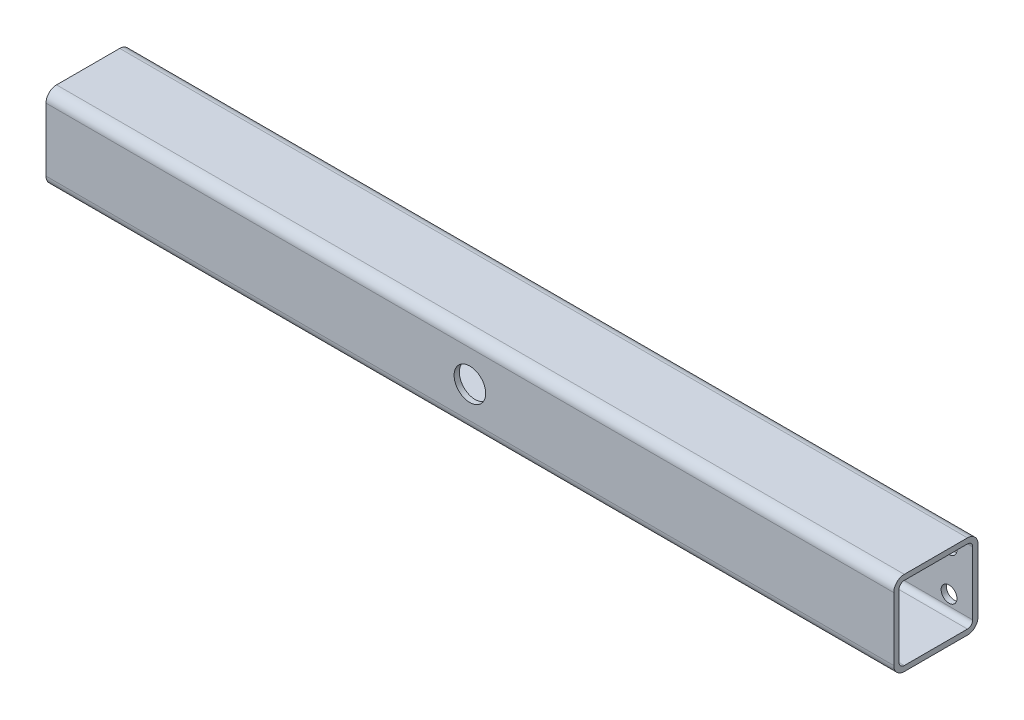
from build123d import *

# Parameters (mm, degrees)
BASE_EXTRUDE_DEPTH = 511.175
SKETCH3_R          = 19.05
CUT_EXTRUDE1_DEPTH = 25.4
SKETCH4_R          = 9.525
CUT_EXTRUDE2_DEPTH = 25.4
SKETCH5_R          = 3.9751
CUT_EXTRUDE3_DEPTH = 25.4


with BuildPart() as part:
    # Sketch1 → Base-Extrude (new, symmetric)
    with BuildSketch(Plane(origin=(0, 0, 0), x_dir=(0, 0, -1), z_dir=(1, 0, 0))):
        with BuildLine():
            Line((-127, 139.7), (-50.8, 139.7))
            ThreePointArc((-50.8, 139.7), (-41.819743879, 135.980256121), (-38.1, 127))
            Line((-38.1, 127), (-38.1, 50.8))
            ThreePointArc((-38.1, 50.8), (-41.819743879, 41.819743879), (-50.8, 38.1))
            Line((-50.8, 38.1), (-127, 38.1))
            ThreePointArc((-127, 38.1), (-135.980256121, 41.819743879), (-139.7, 50.8))
            Line((-139.7, 50.8), (-139.7, 127))
            ThreePointArc((-139.7, 127), (-135.980256121, 135.980256121), (-127, 139.7))
        make_face()
        with BuildLine():
            Line((-127, 133.35), (-50.8, 133.35))
            ThreePointArc((-50.8, 133.35), (-46.309871939, 131.490128061), (-44.45, 127))
            Line((-44.45, 127), (-44.45, 50.8))
            ThreePointArc((-44.45, 50.8), (-46.309871939, 46.309871939), (-50.8, 44.45))
            Line((-50.8, 44.45), (-127, 44.45))
            ThreePointArc((-127, 44.45), (-131.490128061, 46.309871939), (-133.35, 50.8))
            Line((-133.35, 50.8), (-133.35, 127))
            ThreePointArc((-133.35, 127), (-131.490128061, 131.490128061), (-127, 133.35))
        make_face(mode=Mode.SUBTRACT)
    extrude(amount=BASE_EXTRUDE_DEPTH, both=True)

    # Sketch3 → Cut-Extrude1 (cut)
    with BuildSketch(Plane.XY.offset(139.7)):
        with Locations((0, 88.9)):
            Circle(SKETCH3_R)
    extrude(amount=-CUT_EXTRUDE1_DEPTH, mode=Mode.SUBTRACT)

    # Sketch4 → Cut-Extrude2 (cut)
    with BuildSketch(Plane(origin=(0, 0, 38.1), x_dir=(-1, 0, 0), z_dir=(0, 0, -1))):
        with Locations(Location((-482.6, 63.5, 0), (0, 0, 90))):
            Circle(SKETCH4_R)
        with Locations(Location((-482.6, 114.3, 0), (0, 0, 90))):
            Circle(SKETCH4_R)
    cut_extrude2 = extrude(amount=-CUT_EXTRUDE2_DEPTH, mode=Mode.SUBTRACT)

    # Sketch5 → Cut-Extrude3 (cut)
    with BuildSketch(Plane.XZ.offset(-38.1)):
        with Locations(Location((482.6, 120.65, 0), (0, 0, 270))):
            Circle(SKETCH5_R)
    cut_extrude3 = extrude(amount=-CUT_EXTRUDE3_DEPTH, mode=Mode.SUBTRACT)

    # Mirror1: Cut-Extrude2, Cut-Extrude3 across plane
    add(cut_extrude2.mirror(Plane(origin=(0, 0, 0), x_dir=(0, 0, 1), z_dir=(1, 0, 0))), mode=Mode.SUBTRACT)
    add(cut_extrude3.mirror(Plane(origin=(0, 0, 0), x_dir=(0, 0, 1), z_dir=(1, 0, 0))), mode=Mode.SUBTRACT)


solid = part.part
